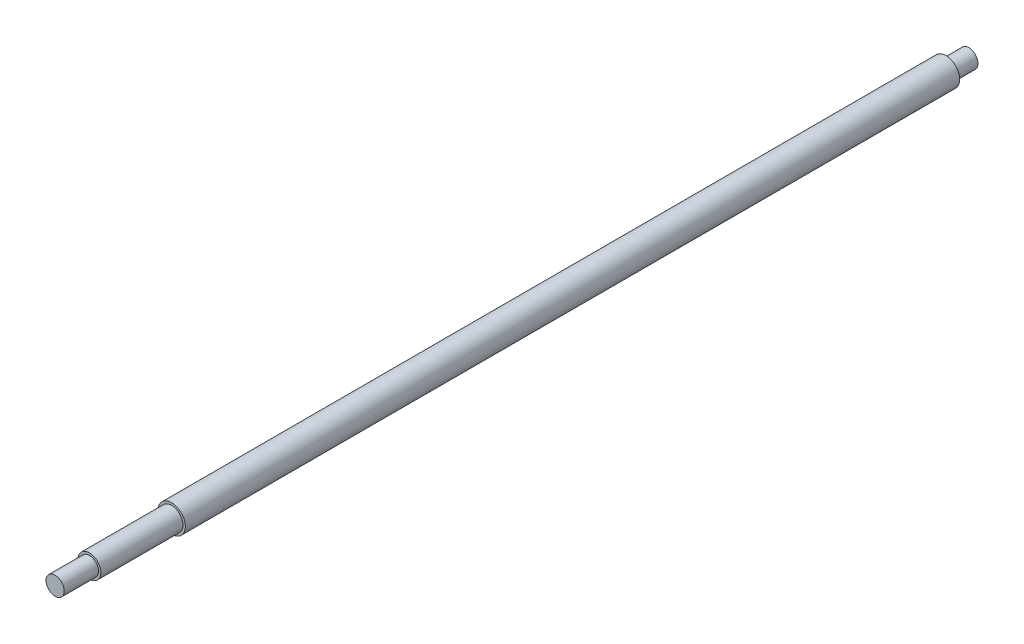
from build123d import *

# Parameters (mm, degrees)
SKETCH_1_R          = 6
EXTRUDE_1_DEPTH     = 400
SKETCH_2_OUTSIDE_W  = 94.072
SKETCH_2_OUTSIDE_H  = 94.072
SKETCH_2_OUTSIDE_R  = 5
CUT_EXTRUDE_1_DEPTH = 51
SKETCH_4_OUTSIDE_W  = 94.072
SKETCH_4_OUTSIDE_H  = 94.072
SKETCH_4_OUTSIDE_R  = 4
CUT_EXTRUDE_3_DEPTH = 15
SKETCH_5_OUTSIDE_W  = 94.072
SKETCH_5_OUTSIDE_H  = 94.072
SKETCH_5_OUTSIDE_R  = 4
CUT_EXTRUDE_4_DEPTH = 10


with BuildPart() as part:
    # Эскиз1 → Бобышка-Вытянуть1 (new body)
    with BuildSketch(Plane.XY):
        Circle(SKETCH_1_R)
    extrude(amount=EXTRUDE_1_DEPTH)

    # Эскиз2 outside → Вырез-Вытянуть1 (cut)
    with BuildSketch(Plane.XY.offset(400)):
        Rectangle(SKETCH_2_OUTSIDE_W, SKETCH_2_OUTSIDE_H)
        Circle(SKETCH_2_OUTSIDE_R, mode=Mode.SUBTRACT)
    extrude(amount=-CUT_EXTRUDE_1_DEPTH, mode=Mode.SUBTRACT)

    # Эскиз4 outside → Вырез-Вытянуть3 (cut)
    with BuildSketch(Plane.XY.offset(400)):
        Rectangle(SKETCH_4_OUTSIDE_W, SKETCH_4_OUTSIDE_H)
        Circle(SKETCH_4_OUTSIDE_R, mode=Mode.SUBTRACT)
    extrude(amount=-CUT_EXTRUDE_3_DEPTH, mode=Mode.SUBTRACT)

    # Эскиз5 outside → Вырез-Вытянуть4 (cut)
    with BuildSketch(Plane(origin=(0, 0, 0), x_dir=(-1, 0, 0), z_dir=(0, 0, -1))):
        Rectangle(SKETCH_5_OUTSIDE_W, SKETCH_5_OUTSIDE_H)
        with Locations(Location((0, 0, 0), (0, 0, 180))):
            Circle(SKETCH_5_OUTSIDE_R, mode=Mode.SUBTRACT)
    extrude(amount=-CUT_EXTRUDE_4_DEPTH, mode=Mode.SUBTRACT)


solid = part.part
